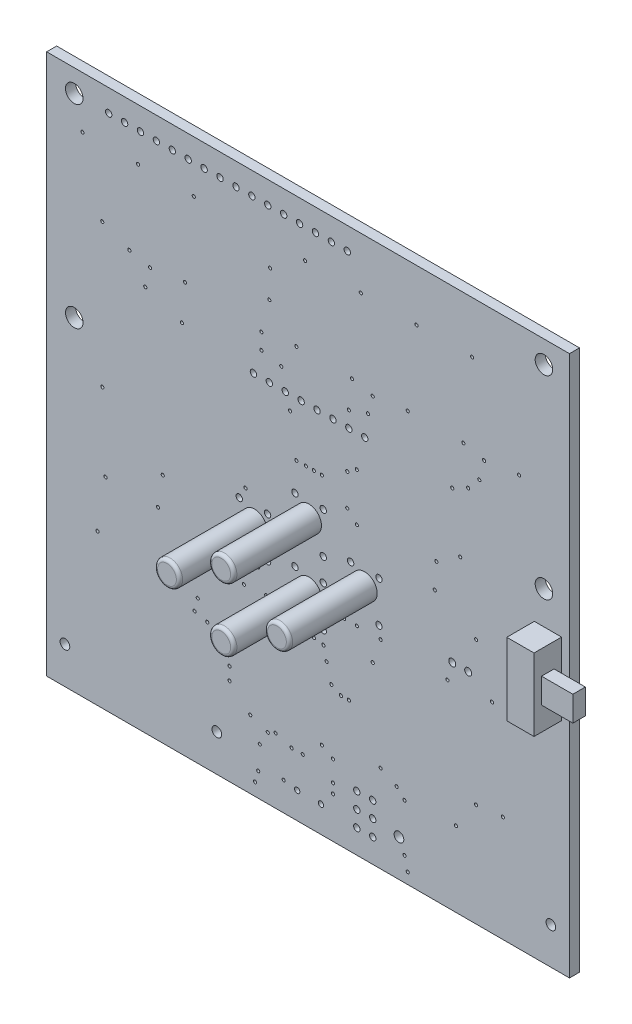
from build123d import *

# Parameters (mm, degrees)
SKETCH_20_W         = 83.49
SKETCH_20_H         = 86.34
SKETCH_20_R         = 0.425
SKETCH_20_R_2       = 0.775
SKETCH_20_R_3       = 1.4
BOSS_EXTRUDE1_DEPTH = 1.6
SKETCH_44_R         = 0.508
SKETCH_44_R_2       = 0.5588
SKETCH_44_R_3       = 0.25
CUT_EXTRUDE3_DEPTH  = 1.6
SKETCH19_W          = 4.346879385
SKETCH19_H          = 11.556648182
BOSS_EXTRUDE4_DEPTH = 4.4
SKETCH20_W          = 2
SKETCH20_H          = 4
BOSS_EXTRUDE5_DEPTH = 5
SKETCH21_R          = 2
BOSS_EXTRUDE6_DEPTH = 14
FILLET1_R           = 0.5


with BuildPart() as part:
    # Sketch 20 → Boss-Extrude1 (new body)
    with BuildSketch(Plane.XY):
        with Locations((41.745, 43.19)):
            Rectangle(SKETCH_20_W, SKETCH_20_H)
        with Locations((40.01, 4.232)):
            Circle(SKETCH_20_R, mode=Mode.SUBTRACT)
        with Locations((43.81, 4.232)):
            Circle(SKETCH_20_R, mode=Mode.SUBTRACT)
        with Locations((27.18, 5.91)):
            Circle(SKETCH_20_R_2, mode=Mode.SUBTRACT)
        with Locations((2.92, 5.91)):
            Circle(SKETCH_20_R_2, mode=Mode.SUBTRACT)
        with Locations((80.52, 5.91)):
            Circle(SKETCH_20_R_2, mode=Mode.SUBTRACT)
        with Locations((56.26, 5.91)):
            Circle(SKETCH_20_R_2, mode=Mode.SUBTRACT)
        with Locations((4.41, 82.81)):
            Circle(SKETCH_20_R_3, mode=Mode.SUBTRACT)
        with Locations((4.41, 51.81)):
            Circle(SKETCH_20_R_3, mode=Mode.SUBTRACT)
        with Locations((79.41, 82.81)):
            Circle(SKETCH_20_R_3, mode=Mode.SUBTRACT)
        with Locations((79.41, 51.81)):
            Circle(SKETCH_20_R_3, mode=Mode.SUBTRACT)
    extrude(amount=BOSS_EXTRUDE1_DEPTH)

    # Sketch 44 → Cut-Extrude3 (cut)
    with BuildSketch(Plane.XY):
        with Locations((52.07, 3.81)):
            Circle(SKETCH_44_R)
        with Locations((49.53, 3.81)):
            Circle(SKETCH_44_R)
        with Locations((52.07, 6.35)):
            Circle(SKETCH_44_R)
        with Locations((49.53, 6.35)):
            Circle(SKETCH_44_R)
        with Locations((52.07, 8.89)):
            Circle(SKETCH_44_R)
        with Locations((49.53, 8.89)):
            Circle(SKETCH_44_R)
        with Locations((67.31, 34.29)):
            Circle(SKETCH_44_R_2)
        with Locations((64.77, 34.29)):
            Circle(SKETCH_44_R_2)
        with Locations((33.02, 58.42)):
            Circle(SKETCH_44_R)
        with Locations((35.56, 58.42)):
            Circle(SKETCH_44_R)
        with Locations((38.1, 58.42)):
            Circle(SKETCH_44_R)
        with Locations((40.64, 58.42)):
            Circle(SKETCH_44_R)
        with Locations((43.18, 58.42)):
            Circle(SKETCH_44_R)
        with Locations((45.72, 58.42)):
            Circle(SKETCH_44_R)
        with Locations((48.26, 58.42)):
            Circle(SKETCH_44_R)
        with Locations((50.8, 58.42)):
            Circle(SKETCH_44_R)
        with Locations((44.1706, 35.0012)):
            Circle(SKETCH_44_R)
        with Locations((44.1706, 28.4988)):
            Circle(SKETCH_44_R)
        with Locations((39.6494, 35.0012)):
            Circle(SKETCH_44_R)
        with Locations((39.6494, 28.4988)):
            Circle(SKETCH_44_R)
        with Locations((44.1706, 45.1612)):
            Circle(SKETCH_44_R)
        with Locations((44.1706, 38.6588)):
            Circle(SKETCH_44_R)
        with Locations((39.6494, 45.1612)):
            Circle(SKETCH_44_R)
        with Locations((39.6494, 38.6588)):
            Circle(SKETCH_44_R)
        with Locations((53.0606, 40.0812)):
            Circle(SKETCH_44_R)
        with Locations((53.0606, 33.5788)):
            Circle(SKETCH_44_R)
        with Locations((48.5394, 40.0812)):
            Circle(SKETCH_44_R)
        with Locations((48.5394, 33.5788)):
            Circle(SKETCH_44_R)
        with Locations((35.2806, 40.0812)):
            Circle(SKETCH_44_R)
        with Locations((35.2806, 33.5788)):
            Circle(SKETCH_44_R)
        with Locations((30.7594, 40.0812)):
            Circle(SKETCH_44_R)
        with Locations((30.7594, 33.5788)):
            Circle(SKETCH_44_R)
        with Locations((80.01, 43.18)):
            Circle(SKETCH_44_R)
        with Locations((80.01, 40.64)):
            Circle(SKETCH_44_R)
        with Locations((80.01, 38.1)):
            Circle(SKETCH_44_R)
        with Locations((9.91, 82.81)):
            Circle(SKETCH_44_R)
        with Locations((12.45, 82.81)):
            Circle(SKETCH_44_R)
        with Locations((14.99, 82.81)):
            Circle(SKETCH_44_R)
        with Locations((17.53, 82.81)):
            Circle(SKETCH_44_R)
        with Locations((20.07, 82.81)):
            Circle(SKETCH_44_R)
        with Locations((22.61, 82.81)):
            Circle(SKETCH_44_R)
        with Locations((25.15, 82.81)):
            Circle(SKETCH_44_R)
        with Locations((27.69, 82.81)):
            Circle(SKETCH_44_R)
        with Locations((30.23, 82.81)):
            Circle(SKETCH_44_R)
        with Locations((32.77, 82.81)):
            Circle(SKETCH_44_R)
        with Locations((35.31, 82.81)):
            Circle(SKETCH_44_R)
        with Locations((37.85, 82.81)):
            Circle(SKETCH_44_R)
        with Locations((40.39, 82.81)):
            Circle(SKETCH_44_R)
        with Locations((42.93, 82.81)):
            Circle(SKETCH_44_R)
        with Locations((45.47, 82.81)):
            Circle(SKETCH_44_R)
        with Locations((48.01, 82.81)):
            Circle(SKETCH_44_R)
        with Locations((25.654, 20.32)):
            Circle(SKETCH_44_R_3)
        with Locations((45.72, 11.43)):
            Circle(SKETCH_44_R_3)
        with Locations((31.496, 28.448)):
            Circle(SKETCH_44_R_3)
        with Locations((44.704, 24.384)):
            Circle(SKETCH_44_R_3)
        with Locations((30.48, 18.796)):
            Circle(SKETCH_44_R_3)
        with Locations((68.58, 16.51)):
            Circle(SKETCH_44_R_3)
        with Locations((29.21, 16.002)):
            Circle(SKETCH_44_R_3)
        with Locations((67.31, 59.69)):
            Circle(SKETCH_44_R_3)
        with Locations((69.85, 64.77)):
            Circle(SKETCH_44_R_3)
        with Locations((48.26, 60.96)):
            Circle(SKETCH_44_R_3)
        with Locations((52.07, 64.77)):
            Circle(SKETCH_44_R_3)
        with Locations((34.29, 64.77)):
            Circle(SKETCH_44_R_3)
        with Locations((39.878, 49.784)):
            Circle(SKETCH_44_R_3)
        with Locations((37.465, 61.595)):
            Circle(SKETCH_44_R_3)
        with Locations((41.402, 49.784)):
            Circle(SKETCH_44_R_3)
        with Locations((21.59, 59.69)):
            Circle(SKETCH_44_R_3)
        with Locations((16.51, 64.77)):
            Circle(SKETCH_44_R_3)
        with Locations((42.672, 49.784)):
            Circle(SKETCH_44_R_3)
        with Locations((43.942, 49.784)):
            Circle(SKETCH_44_R_3)
        with Locations((36.576, 10.414)):
            Circle(SKETCH_44_R_3)
        with Locations((40.894, 9.652)):
            Circle(SKETCH_44_R_3)
        with Locations((35.306, 9.906)):
            Circle(SKETCH_44_R_3)
        with Locations((39.116, 9.652)):
            Circle(SKETCH_44_R_3)
        with Locations((62.23, 46.99)):
            Circle(SKETCH_44_R_3)
        with Locations((48.26, 20.828)):
            Circle(SKETCH_44_R_3)
        with Locations((24.13, 22.86)):
            Circle(SKETCH_44_R_3)
        with Locations((40.894, 26.67)):
            Circle(SKETCH_44_R_3)
        with Locations((40.894, 32.766)):
            Circle(SKETCH_44_R_3)
        with Locations((37.846, 27.686)):
            Circle(SKETCH_44_R_3)
        with Locations((47.498, 31.75)):
            Circle(SKETCH_44_R_3)
        with Locations((49.53, 31.75)):
            Circle(SKETCH_44_R_3)
        with Locations((53.34, 31.75)):
            Circle(SKETCH_44_R_3)
        with Locations((64.008, 31.496)):
            Circle(SKETCH_44_R_3)
        with Locations((8.128, 24.13)):
            Circle(SKETCH_44_R_3)
        with Locations((38.862, 26.67)):
            Circle(SKETCH_44_R_3)
        with Locations((55.88, 12.7)):
            Circle(SKETCH_44_R_3)
        with Locations((32.512, 10.922)):
            Circle(SKETCH_44_R_3)
        with Locations((67.945, 78.105)):
            Circle(SKETCH_44_R_3)
        with Locations((59.055, 78.105)):
            Circle(SKETCH_44_R_3)
        with Locations((50.165, 78.105)):
            Circle(SKETCH_44_R_3)
        with Locations((41.275, 78.105)):
            Circle(SKETCH_44_R_3)
        with Locations((35.687, 74.295)):
            Circle(SKETCH_44_R_3)
        with Locations((23.495, 78.105)):
            Circle(SKETCH_44_R_3)
        with Locations((5.715, 78.105)):
            Circle(SKETCH_44_R_3)
        with Locations((14.605, 78.105)):
            Circle(SKETCH_44_R_3)
        with Locations((13.208, 65.532)):
            Circle(SKETCH_44_R_3)
        with Locations((48.768, 65.532)):
            Circle(SKETCH_44_R_3)
        with Locations((66.548, 65.532)):
            Circle(SKETCH_44_R_3)
        with Locations((57.658, 65.532)):
            Circle(SKETCH_44_R_3)
        with Locations((75.438, 65.532)):
            Circle(SKETCH_44_R_3)
        with Locations((39.878, 65.532)):
            Circle(SKETCH_44_R_3)
        with Locations((22.098, 65.532)):
            Circle(SKETCH_44_R_3)
        with Locations((69.088, 61.722)):
            Circle(SKETCH_44_R_3)
        with Locations((51.308, 61.976)):
            Circle(SKETCH_44_R_3)
        with Locations((34.29, 62.23)):
            Circle(SKETCH_44_R_3)
        with Locations((15.748, 61.722)):
            Circle(SKETCH_44_R_3)
        with Locations((61.976, 42.926)):
            Circle(SKETCH_44_R_3)
        with Locations((68.58, 39.37)):
            Circle(SKETCH_44_R_3)
        with Locations((71.12, 32.004)):
            Circle(SKETCH_44_R_3)
        with Locations((38.862, 56.134)):
            Circle(SKETCH_44_R_3)
        with Locations((48.006, 52.324)):
            Circle(SKETCH_44_R_3)
        with Locations((48.006, 47.244)):
            Circle(SKETCH_44_R_3)
        with Locations((66.04, 49.53)):
            Circle(SKETCH_44_R_3)
        with Locations((52.07, 27.94)):
            Circle(SKETCH_44_R_3)
        with Locations((53.34, 13.97)):
            Circle(SKETCH_44_R_3)
        with Locations((45.72, 6.604)):
            Circle(SKETCH_44_R_3)
        with Locations((34.036, 7.62)):
            Circle(SKETCH_44_R_3)
        with Locations((9.398, 32.258)):
            Circle(SKETCH_44_R_3)
        with Locations((17.78, 32.258)):
            Circle(SKETCH_44_R_3)
        with Locations((18.542, 37.084)):
            Circle(SKETCH_44_R_3)
        with Locations((33.782, 32.004)):
            Circle(SKETCH_44_R_3)
        with Locations((35.56, 69.85)):
            Circle(SKETCH_44_R_3)
        with Locations((49.53, 45.72)):
            Circle(SKETCH_44_R_3)
        with Locations((29.21, 13.97)):
            Circle(SKETCH_44_R_3)
        with Locations((42.672, 26.67)):
            Circle(SKETCH_44_R_3)
        with Locations((8.89, 44.45)):
            Circle(SKETCH_44_R_3)
        with Locations((36.576, 27.432)):
            Circle(SKETCH_44_R_3)
        with Locations((29.21, 30.48)):
            Circle(SKETCH_44_R_3)
        with Locations((27.94, 20.32)):
            Circle(SKETCH_44_R_3)
        with Locations((43.942, 12.446)):
            Circle(SKETCH_44_R_3)
        with Locations((31.75, 41.91)):
            Circle(SKETCH_44_R_3)
        with Locations((35.052, 28.702)):
            Circle(SKETCH_44_R_3)
        with Locations((37.338, 26.416)):
            Circle(SKETCH_44_R_3)
        with Locations((38.1, 25.4)):
            Circle(SKETCH_44_R_3)
        with Locations((33.274, 2.032)):
            Circle(SKETCH_44_R_3)
        with Locations((23.622, 20.828)):
            Circle(SKETCH_44_R_3)
        with Locations((72.85, 16.97)):
            Circle(SKETCH_44_R_3)
        with Locations((57.658, 1.778)):
            Circle(SKETCH_44_R_3)
        with Locations((74.93, 36.83)):
            Circle(SKETCH_44_R_3)
        with Locations((64.77, 58.42)):
            Circle(SKETCH_44_R_3)
        with Locations((8.89, 67.31)):
            Circle(SKETCH_44_R_3)
        with Locations((45.72, 8.128)):
            Circle(SKETCH_44_R_3)
        with Locations((33.782, 3.81)):
            Circle(SKETCH_44_R_3)
        with Locations((57.15, 3.81)):
            Circle(SKETCH_44_R_3)
        with Locations((65.35, 12.01)):
            Circle(SKETCH_44_R_3)
        with Locations((39.37, 41.91)):
            Circle(SKETCH_44_R_3)
        with Locations((44.196, 26.416)):
            Circle(SKETCH_44_R_3)
        with Locations((49.53, 53.34)):
            Circle(SKETCH_44_R_3)
        with Locations((45.466, 21.59)):
            Circle(SKETCH_44_R_3)
        with Locations((46.99, 20.828)):
            Circle(SKETCH_44_R_3)
        with Locations((46.228, 31.75)):
            Circle(SKETCH_44_R_3)
        with Locations((57.15, 11.43)):
            Circle(SKETCH_44_R_3)
        with Locations((37.846, 4.572)):
            Circle(SKETCH_44_R_3)
    extrude(amount=CUT_EXTRUDE3_DEPTH, mode=Mode.SUBTRACT)

    # Sketch19 → Boss-Extrude4 (add)
    with BuildSketch(Plane.XY.offset(1.6)):
        with Locations((80.051684532, 40.757308925)):
            Rectangle(SKETCH19_W, SKETCH19_H)
    extrude(amount=BOSS_EXTRUDE4_DEPTH)

    # Sketch20 → Boss-Extrude5 (add)
    with BuildSketch(Plane(origin=(82.225124224, 0, 0), x_dir=(0, 0, -1), z_dir=(1, 0, 0))):
        with Locations((-3.8, 40.728984834)):
            Rectangle(SKETCH20_W, SKETCH20_H)
    extrude(amount=BOSS_EXTRUDE5_DEPTH)

    # Sketch21 → Boss-Extrude6 (add)
    with BuildSketch(Plane.XY.offset(1.6)):
        with Locations((33.218126269, 37.718620573)):
            Circle(SKETCH21_R)
        with Locations((41.882871376, 42.761963688)):
            Circle(SKETCH21_R)
        with Locations((50.777163588, 37.844472794)):
            Circle(SKETCH21_R)
        with Locations((41.882871376, 32.674568852)):
            Circle(SKETCH21_R)
    extrude(amount=BOSS_EXTRUDE6_DEPTH)

    # Fillet1
    fillet1_edges = [part.edges().sort_by_distance(p)[0] for p in [
        (48.777163588, 37.844472794, 15.6),
        (39.882871376, 42.761963688, 15.6),
        (39.882871376, 32.674568852, 15.6),
        (31.218126269, 37.718620573, 15.6),
    ]]
    fillet(fillet1_edges, radius=FILLET1_R)


solid = part.part
